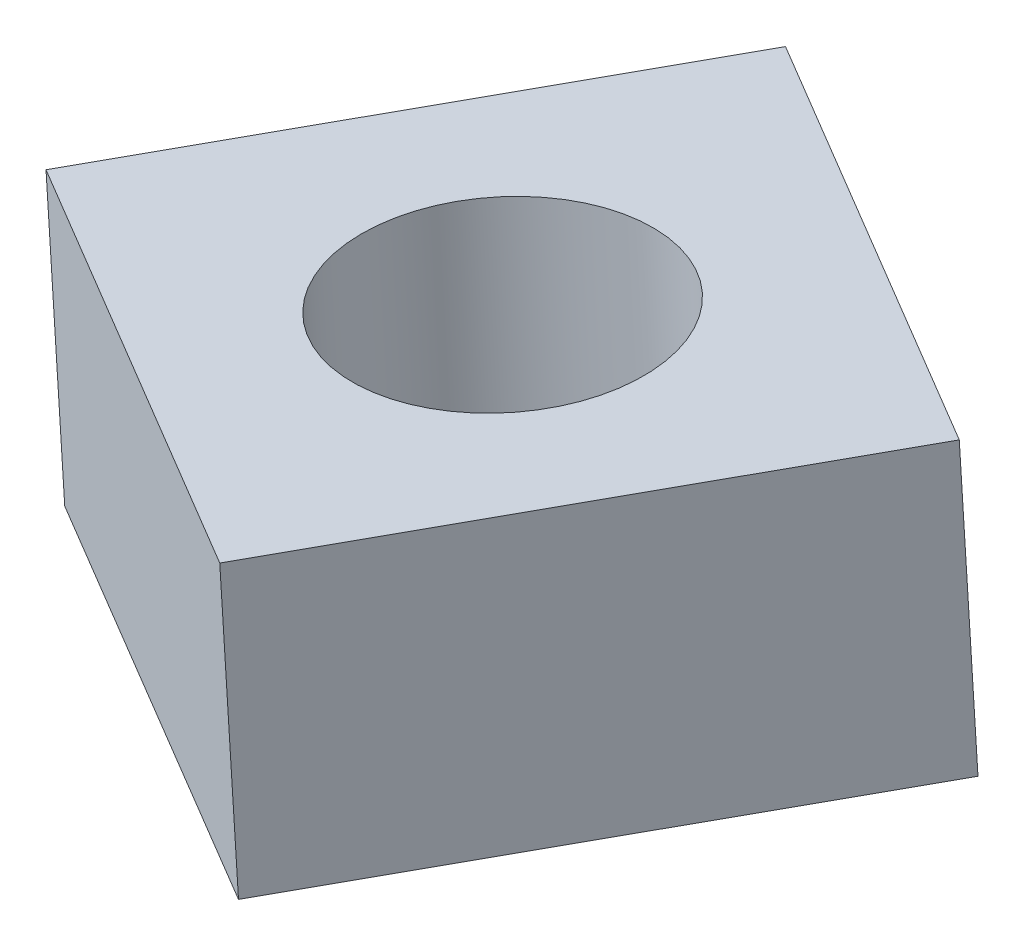
from build123d import *

# Parameters (mm, degrees)
ESQUISSE1_R          = 2.5
BASE_EXTRUSION_DEPTH = 5


with BuildPart() as part:
    # Esquisse1 → Base-Extrusion (new body)
    with BuildSketch(Plane(origin=(-26.838331037, 415.169970955, 0.701283169), x_dir=(0.9979170895355154, 0.06450955288146361, 0), z_dir=(0.06450946123472912, -0.9979156718254485, -0.0016856264025107183))):
        Polygon((1614.049666819, 1079.564853157), (1619.044556774, 1071.483945142), (1627.125464789, 1076.478835096), (1622.130574834, 1084.559743111), align=None)
        with Locations(Location((1620.587565804, 1078.021844127, 0), (0, 0, 180))):
            Circle(ESQUISSE1_R, mode=Mode.SUBTRACT)
    extrude(amount=-BASE_EXTRUSION_DEPTH)


solid = part.part
